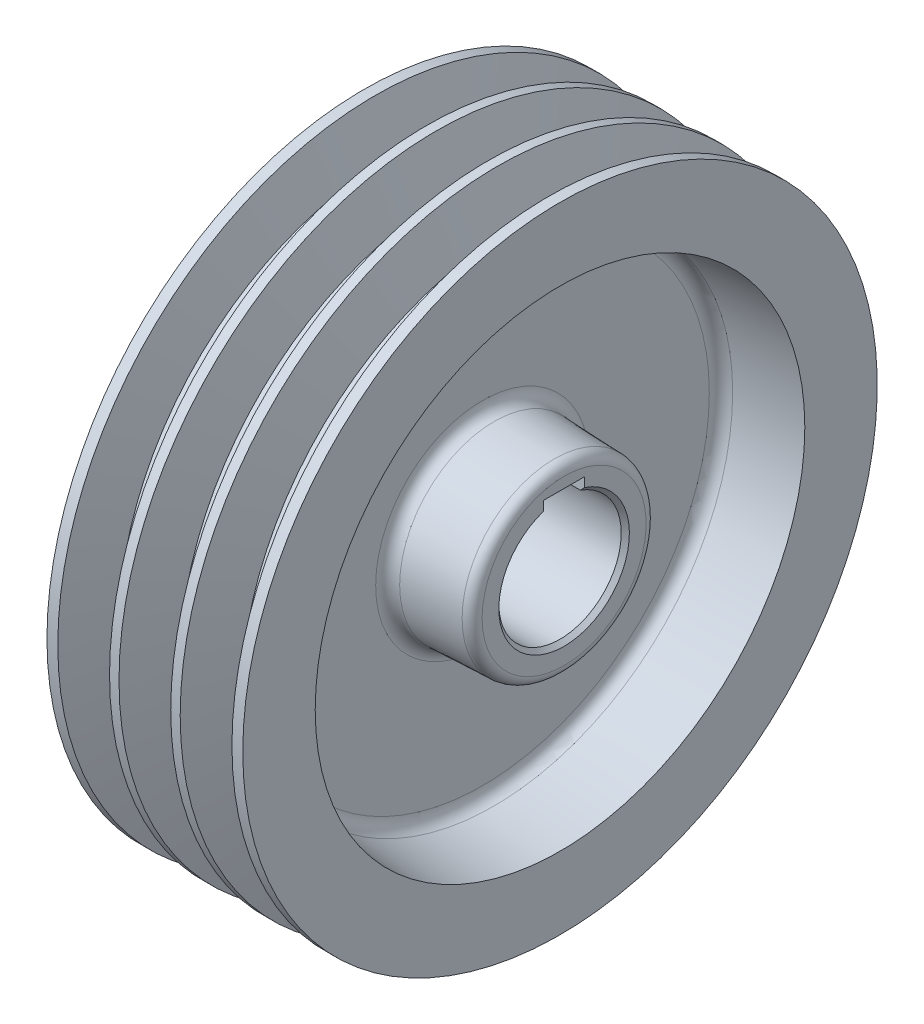
from build123d import *

# Parameters (mm, degrees)
PATTERN_LINEAR_961_COUNT = 3
PATTERN_LINEAR_961_PITCH = 15
CHAMFER_1_SIZE           = 1
SKETCH_4_W               = 10
SKETCH_4_H               = 3.357864376
CUT_EXTRUDE_1_DEPTH      = 121.789589783
FILLET_1_R               = 3
FILLET_2_R               = 2.5


with BuildPart() as part:
    # 草图1 → 旋转1 (revolve)
    with BuildSketch(Plane.XY, mode=Mode.PRIVATE) as revolve_1_sk:
        Polygon((-1, 15), (-1, 22.5), (19, 24.249773271), (19, 59.240202621), (0, 60), (0, 77.75), (48, 77.75), (48, 60), (29, 58.337715393), (29, 23.299786714), (49, 22.5), (49, 15), align=None)
    revolve(revolve_1_sk.sketch.rotate(Axis((0, 0, 0), (1, 0, 0)), 90), axis=Axis((0, 0, 0), (1, 0, 0)))

    # 草图2 → 切除-旋转1 (revolve, cut)
    with BuildSketch(Plane.XY, mode=Mode.PRIVATE) as cut_revolve_1_sk:
        Polygon((11.840143071, 66.3), (15.340759374, 77.75), (2.659240626, 77.75), (6.159856929, 66.3), align=None)
    cut_revolve_1 = revolve(cut_revolve_1_sk.sketch.rotate(Axis((0, 0, 0), (1, 0, 0)), 90), axis=Axis((0, 0, 0), (1, 0, 0)), mode=Mode.SUBTRACT)

    # Pattern Linear 961: 切除-旋转1 ×3
    with Locations(*[(i * PATTERN_LINEAR_961_PITCH, 0, 0) for i in range(1, PATTERN_LINEAR_961_COUNT)]):
        add(cut_revolve_1, mode=Mode.SUBTRACT)

    # 倒角1
    chamfer_1_edges = [part.edges().sort_by_distance(p)[0] for p in [
        (-1, 0, -15),
        (49, 0, -15),
    ]]
    chamfer(chamfer_1_edges, length=CHAMFER_1_SIZE)

    # 草图4 → 切除-拉伸1 (cut, through all)
    with BuildSketch(Plane.ZY.offset(1)):
        with Locations((0, 15.821067812)):
            Rectangle(SKETCH_4_W, SKETCH_4_H)
    extrude(amount=-CUT_EXTRUDE_1_DEPTH, mode=Mode.SUBTRACT)

    # 圆角1
    fillet_1_edges = [part.edges().sort_by_distance(p)[0] for p in [
        (19, 0, -59.240202621),
        (19, 0, -24.249773271),
        (29, 0, -23.299786714),
        (29, 0, -58.337715393),
    ]]
    fillet(fillet_1_edges, radius=FILLET_1_R)

    # 圆角2
    fillet_2_edges = [part.edges().sort_by_distance(p)[0] for p in [
        (-1, 0, -22.5),
        (49, 0, -22.5),
    ]]
    fillet(fillet_2_edges, radius=FILLET_2_R)


solid = part.part
